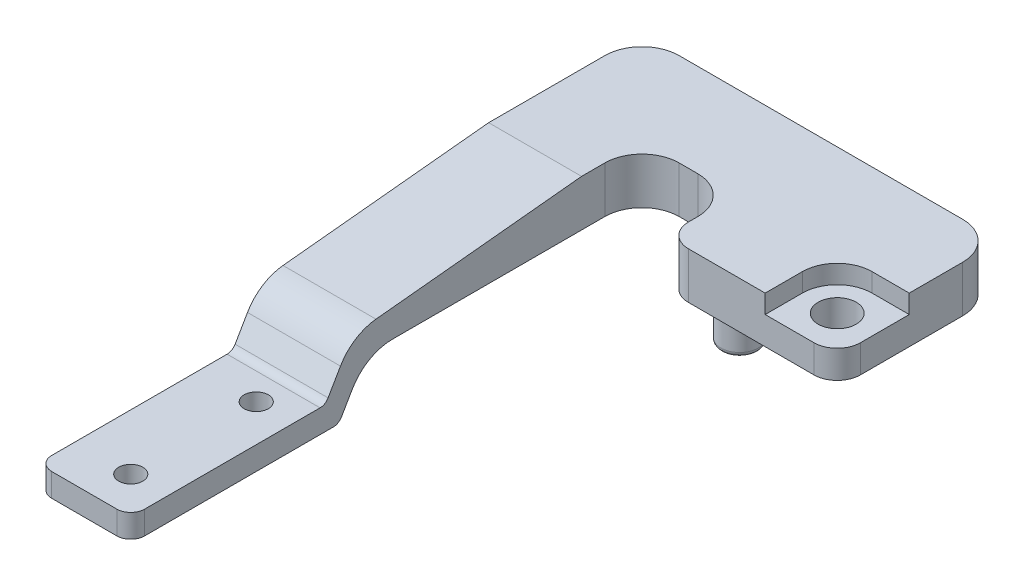
from build123d import *
from build123d.topology import SkipClean

# Parameters (mm, degrees)
SKETCH1_R                = 4.1
SKETCH1_R_2              = 4
SKETCH1_R_3              = 2.6
BOSS_EXTRUDE1_DEPTH      = 10
CUT_EXTRUDE1_START       = -4
CUT_EXTRUDE1_DEPTH       = 4
BOSS_EXTRUDE2_DEPTH      = 10
BOSS_EXTRUDE2_DEPTH_BACK = 10
SKETCH5_R                = 4
FILLET1_R                = 1
BOSS_EXTRUDE3_START      = 10
SKETCH6_R                = 2.6
BOSS_EXTRUDE3_DEPTH      = 10
BOSS_EXTRUDE4_DEPTH      = 20
CUT_EXTRUDE2_REACH       = 125.31
FILLET2_R                = 10
FILLET3_R                = 2


with BuildPart() as part:
    # Sketch1 → Boss-Extrude1 (new body)
    with BuildSketch(Plane(origin=(0, 0, 0), x_dir=(1, 0, 0), z_dir=(0, 1, 0))):
        with BuildLine():
            Line((28.853428594, -0.793287448), (1.853428594, -0.793287448))
            ThreePointArc((1.853428594, -0.793287448), (-1.682105312, 0.671178646), (-3.146571406, 4.206712552))
            Line((-3.146571406, 4.206712552), (-3.146571406, 6.206712552))
            ThreePointArc((-3.146571406, 6.206712552), (-5.489717157, 11.863566801), (-11.146571406, 14.206712552))
            Line((-11.146571406, 14.206712552), (-15.146571406, 14.206712552))
            ThreePointArc((-15.146571406, 14.206712552), (-20.803425656, 11.863566801), (-23.146571406, 6.206712552))
            Line((-23.146571406, 6.206712552), (-23.146571406, -92.793287448))
            ThreePointArc((-23.146571406, -92.793287448), (-24.025251062, -94.914607792), (-26.146571406, -95.793287448))
            Line((-26.146571406, -95.793287448), (-40.146571406, -95.793287448))
            ThreePointArc((-40.146571406, -95.793287448), (-42.26789175, -94.914607792), (-43.146571406, -92.793287448))
            Line((-43.146571406, -92.793287448), (-43.146571406, 4.206712552))
            Line((-43.146571406, 4.206712552), (-43.146571406, 26.206712552))
            ThreePointArc((-43.146571406, 26.206712552), (-40.803425656, 31.863566801), (-35.146571406, 34.206712552))
            Line((-35.146571406, 34.206712552), (-3.146571406, 34.206712552))
            Line((-3.146571406, 34.206712552), (25.853428594, 34.206712552))
            ThreePointArc((25.853428594, 34.206712552), (31.510282843, 31.863566801), (33.853428594, 26.206712552))
            Line((33.853428594, 26.206712552), (33.853428594, 4.206712552))
            ThreePointArc((33.853428594, 4.206712552), (32.3889625, 0.671178646), (28.853428594, -0.793287448))
        make_face()
        with Locations(Location((25.853428594, 7.206712552, 0), (0, 0, 270))):
            Circle(SKETCH1_R, mode=Mode.SUBTRACT)
        with Locations(Location((4.853428594, 7.206712552, 0), (0, 0, 270))):
            Circle(SKETCH1_R_2, mode=Mode.SUBTRACT)
        with Locations(Location((-31.146571406, -87.793287448, 0), (0, 0, 270))):
            Circle(SKETCH1_R_3, mode=Mode.SUBTRACT)
        with Locations(Location((-31.146571406, -60.793287448, 0), (0, 0, 270))):
            Circle(SKETCH1_R_3, mode=Mode.SUBTRACT)
    extrude(amount=BOSS_EXTRUDE1_DEPTH)

    # Sketch2 → Cut-Extrude1 (cut)
    with BuildSketch(Plane(origin=(0, 10, 0), x_dir=(1, 0, 0), z_dir=(0, 1, 0)).offset(CUT_EXTRUDE1_START)):
        with BuildLine():
            Line((25.853428594, 14.706712552), (33.853428594, 14.706712552))
            Line((33.853428594, 14.706712552), (33.853428594, 4.206712552))
            ThreePointArc((33.853428594, 4.206712552), (32.3889625, 0.671178646), (28.853428594, -0.793287448))
            Line((28.853428594, -0.793287448), (18.353428594, -0.793287448))
            Line((18.353428594, -0.793287448), (18.353428594, 7.206712552))
            ThreePointArc((18.353428594, 7.206712552), (20.550127735, 12.510013411), (25.853428594, 14.706712552))
        make_face()
    extrude(amount=CUT_EXTRUDE1_DEPTH, mode=Mode.SUBTRACT)

    # Sketch5 → Boss-Extrude2 (add, two sides: drawn at the far end of the back side and taken through both)
    with BuildSketch(Plane(origin=(0, 0, 0), x_dir=(-1, 0, 0), z_dir=(0, -1, 0)).offset(-BOSS_EXTRUDE2_DEPTH_BACK)):
        with Locations(Location((-4.853428594, 7.206712552, 0), (0, 0, 90))):
            Circle(SKETCH5_R)
    extrude(amount=BOSS_EXTRUDE2_DEPTH + BOSS_EXTRUDE2_DEPTH_BACK)

    # Fillet1
    fillet1_edges = [part.edges().sort_by_distance(p)[0] for p in [
        (4.853428594, 0, -3.206712552),
        (4.853428594, -10, -3.206712552),
    ]]
    fillet(fillet1_edges, radius=FILLET1_R)

    # Sketch6 → Boss-Extrude3 (add)
    with SkipClean():  # the faces are left unmerged after this step: merging them gives an invalid solid
        with BuildSketch(Plane.XZ.offset(BOSS_EXTRUDE3_START)):
            with BuildLine():
                Line((-26.146571406, 95.793287448), (-40.146571406, 95.793287448))
                ThreePointArc((-40.146571406, 95.793287448), (-42.26789175, 94.914607792), (-43.146571406, 92.793287448))
                Line((-43.146571406, 92.793287448), (-43.146571406, 51.031484515))
                Line((-43.146571406, 51.031484515), (-23.146571406, 51.031484515))
                Line((-23.146571406, 51.031484515), (-23.146571406, 92.793287448))
                ThreePointArc((-23.146571406, 92.793287448), (-24.025251062, 94.914607792), (-26.146571406, 95.793287448))
            make_face()
            with Locations(Location((-31.146571406, 87.793287448, 0), (0, 0, 270))):
                Circle(SKETCH6_R, mode=Mode.SUBTRACT)
            with Locations(Location((-31.146571406, 60.793287448, 0), (0, 0, 270))):
                Circle(SKETCH6_R, mode=Mode.SUBTRACT)
        extrude(amount=-BOSS_EXTRUDE3_DEPTH)

    # Sketch7 → Boss-Extrude4 (add)
    with SkipClean():  # the faces are left unmerged after this step: merging them gives an invalid solid
        with BuildSketch(Plane(origin=(-23.146571406, 0, 0), x_dir=(0, 0, -1), z_dir=(1, 0, 0))):
            Polygon((-51.031484515, -10), (-45.232749266, 0), (-51.031484515, 0), align=None)
        extrude(amount=-BOSS_EXTRUDE4_DEPTH)

    # Cut-Extrude2: up to this face of the body (flat: up to its plane)
    cut_extrude2_end = Plane(part.part.faces().sort_by_distance((-23.146571406, 5, 43.293287448))[0])
    # Sketch8 → Cut-Extrude2 (cut, up to the picked face)
    with BuildSketch(Plane.ZY.offset(43.146571406), mode=Mode.PRIVATE) as cut_extrude2_sk1:
        Polygon((53.911938049, -5), (48.1132028, 5), (-1.206712552, 10), (103.677305794, 10), (103.677305794, -5), align=None)
    cut_extrude2_tool1 = split(extrude(cut_extrude2_sk1.sketch, amount=-CUT_EXTRUDE2_REACH, mode=Mode.PRIVATE), bisect_by=cut_extrude2_end, keep=Keep.BOTH, mode=Mode.PRIVATE)
    add(cut_extrude2_tool1.solids().sort_by(Axis((-43.146571, 3.405459, 70.825985), (1, 0, 0)))[0], mode=Mode.SUBTRACT)

    # Fillet2
    fillet2_edges = [part.edges().sort_by_distance(p)[0] for p in [
        (-33.146571406, 0, 45.232749266),
        (-33.146571406, 5, 48.1132028),
    ]]
    fillet(fillet2_edges, radius=FILLET2_R)

    # Fillet3
    fillet3_edges = [part.edges().sort_by_distance(p)[0] for p in [
        (-33.146571406, -10, 51.031484515),
        (-33.146571406, -5, 53.911938049),
    ]]
    fillet(fillet3_edges, radius=FILLET3_R)


solid = part.part
